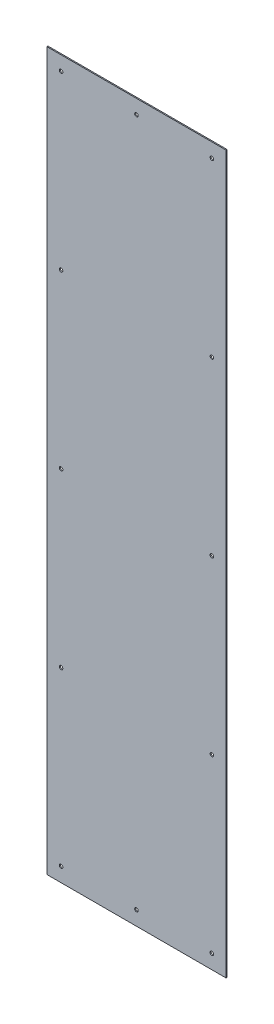
from build123d import *

# Parameters (mm, degrees)
CROQUIS1_W              = 320
CROQUIS1_H              = 1280
SALIENTE_EXTRUIR1_DEPTH = 1.9
CROQUIS2_R              = 3.175
CORTAR_EXTRUIR1_DEPTH   = 10


with BuildPart() as part:
    # Croquis1 → Saliente-Extruir1 (new body)
    with BuildSketch(Plane.XY):
        Rectangle(CROQUIS1_W, CROQUIS1_H)
    extrude(amount=SALIENTE_EXTRUIR1_DEPTH)

    # Croquis2 → Cortar-Extruir1 (cut)
    with BuildSketch(Plane.XY.offset(1.9)):
        with Locations((-134.6, 614.6)):
            Circle(CROQUIS2_R)
        with Locations((134.6, 614.6)):
            Circle(CROQUIS2_R)
        with Locations((134.6, -614.6)):
            Circle(CROQUIS2_R)
        with Locations((-134.6, -614.6)):
            Circle(CROQUIS2_R)
        with Locations((0, 614.6)):
            Circle(CROQUIS2_R)
        with Locations((0, -614.6)):
            Circle(CROQUIS2_R)
        with Locations((-134.6, 0)):
            Circle(CROQUIS2_R)
        with Locations((134.6, 0)):
            Circle(CROQUIS2_R)
        with Locations((-134.6, -307.3)):
            Circle(CROQUIS2_R)
        with Locations((134.6, -307.3)):
            Circle(CROQUIS2_R)
        with Locations((-134.6, 307.3)):
            Circle(CROQUIS2_R)
        with Locations((134.6, 307.3)):
            Circle(CROQUIS2_R)
    extrude(amount=-CORTAR_EXTRUIR1_DEPTH, mode=Mode.SUBTRACT)


solid = part.part
